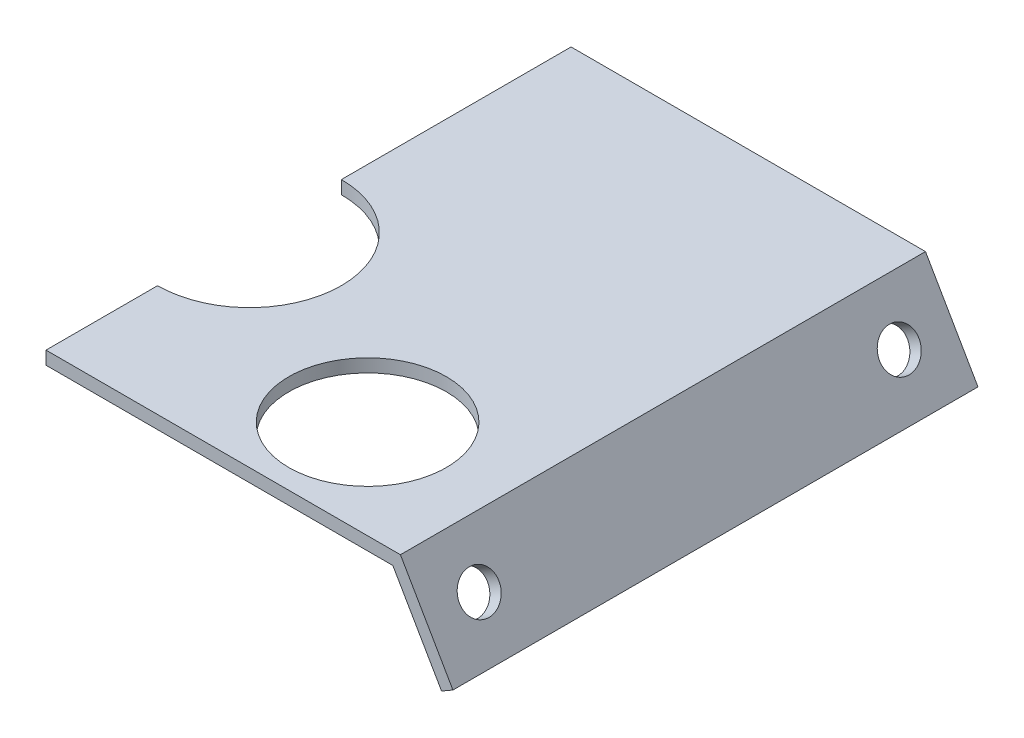
from build123d import *

# Parameters (mm, degrees)
BOSS_EXTRUDE1_DEPTH = 40
SKETCH2_R           = 1.5
CUT_EXTRUDE1_DEPTH  = 40
SKETCH3_R           = 7
SKETCH3_R_2         = 6
CUT_EXTRUDE2_DEPTH  = 40


with BuildPart() as part:
    # Sketch1 → Boss-Extrude1 (new body)
    with BuildSketch(Plane.XY):
        Polygon((0, 0), (27, 0), (31, -6.92820323), (30.133974596, -7.42820323), (26.422649731, -1), (0, -1), align=None)
    extrude(amount=BOSS_EXTRUDE1_DEPTH)

    # Sketch2 → Cut-Extrude1 (cut)
    with BuildSketch(Plane(origin=(20.25, 11.691342951, 0), x_dir=(0, 0, -1), z_dir=(0.86602540378444, 0.4999999999999978, 0))):
        with Locations(Location((-36, -17.5, 0), (0, 0, 90))):
            Circle(SKETCH2_R)
        with Locations(Location((-4, -17.5, 0), (0, 0, 90))):
            Circle(SKETCH2_R)
    extrude(amount=-CUT_EXTRUDE1_DEPTH, mode=Mode.SUBTRACT)

    # Sketch3 → Cut-Extrude2 (cut)
    with BuildSketch(Plane(origin=(0, 0, 0), x_dir=(-1, 0, 0), z_dir=(0, 1, 0))):
        with Locations((0, 24.5)):
            Circle(SKETCH3_R)
        with Locations(Location((-17, 32.5, 0), (0, 0, 90))):
            Circle(SKETCH3_R_2)
    extrude(amount=-CUT_EXTRUDE2_DEPTH, mode=Mode.SUBTRACT)


solid = part.part
